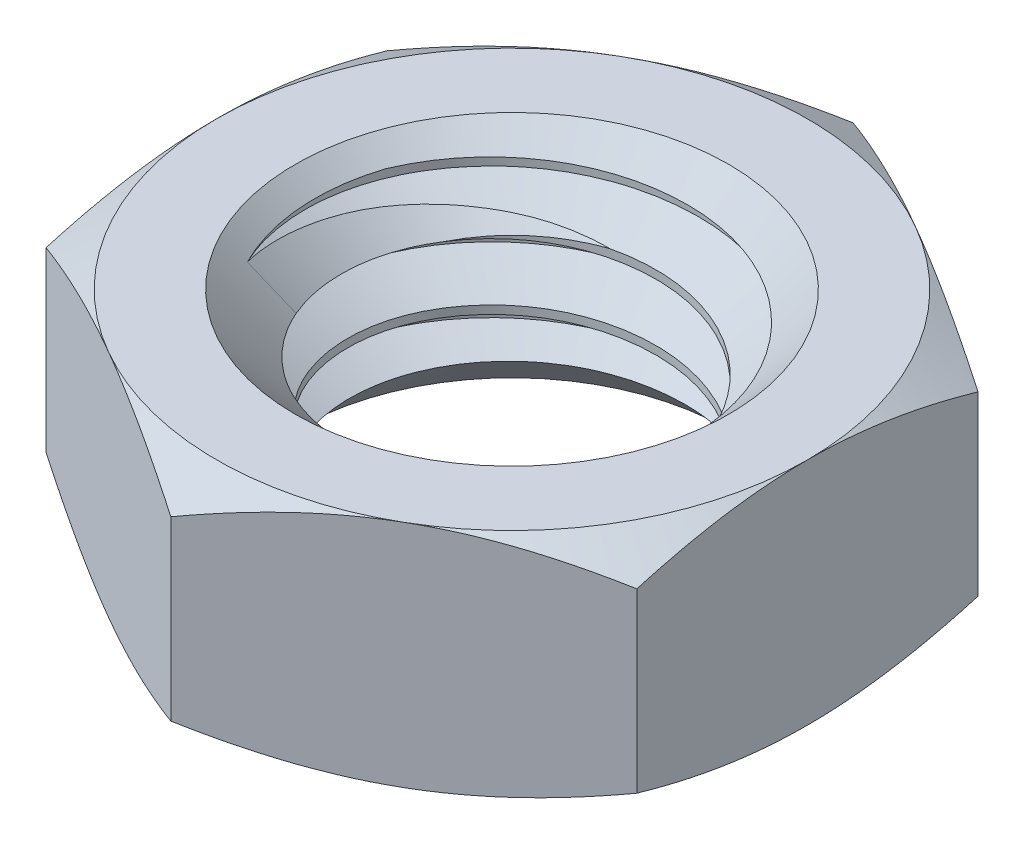
from build123d import *

# Parameters (mm, degrees)
BOSS_EXTRUDE1_DEPTH      = 2.778125
BOSS_EXTRUDE1_DEPTH_BACK = 2.778125
SKETCH2_R                = 4.7625
SKETCH4_R                = 4.7625
BOSS_EXTRUDE2_DEPTH      = 5.55625
CUT_SWEEP1_PITCH         = 1.5875
CUT_SWEEP1_HEIGHT        = 7.14375
CUT_SWEEP1_RADIUS        = 4.7625
CUT_SWEEP1_START_ANGLE   = 180
SKETCH8_R                = 5.23875
BOSS_EXTRUDE3_DEPTH      = 5.55625


with BuildPart() as part:
    # Sketch2 → Boss-Extrude1 (new, two sides: drawn at the far end of the back side and taken through both)
    with BuildSketch(Plane(origin=(0, 0, 0), x_dir=(1, 0, 0), z_dir=(0, 1, 0)).offset(-BOSS_EXTRUDE1_DEPTH_BACK)):
        Polygon((0, 8.248891971), (-7.14375, 4.124445986), (-7.14375, -4.124445986), (0, -8.248891971), (7.14375, -4.124445986), (7.14375, 4.124445986), align=None)
        with Locations(Location((0, 0, 0), (0, 0, 270))):
            Circle(SKETCH2_R, mode=Mode.SUBTRACT)
    extrude(amount=BOSS_EXTRUDE1_DEPTH + BOSS_EXTRUDE1_DEPTH_BACK)

    # Sketch3 → Cut-Revolve1 (revolve, cut)
    with BuildSketch(Plane(origin=(0, 0, 0), x_dir=(0, 0, -1), z_dir=(1, 0, 0))):
        Polygon((-8.248891971, 2.140070986), (-7.14375, 2.778125), (-8.248891971, 2.778125), align=None)
        Polygon((-8.248891971, -2.140070986), (-7.14375, -2.778125), (-8.248891971, -2.778125), align=None)
        Polygon((-5.23875, 2.778125), (-4.7625, 2.778125), (-4.7625, 2.301875), align=None)
        Polygon((-5.23875, -2.778125), (-4.7625, -2.778125), (-4.7625, -2.301875), align=None)
    revolve(axis=Axis((0, 2.778125, 0), (0, -1, 0)), mode=Mode.SUBTRACT)

    # Sketch8 → Boss-Extrude3 (add)
    with BuildSketch(Plane(origin=(0, 2.778125, 0), x_dir=(1, 0, 0), z_dir=(0, 1, 0))):
        Circle(SKETCH8_R)
    extrude(amount=-BOSS_EXTRUDE3_DEPTH)


with BuildPart() as body_2:
    # Sketch4 → Boss-Extrude2 (new body)
    with BuildSketch(Plane(origin=(0, 2.778125, 0), x_dir=(1, 0, 0), z_dir=(0, 1, 0))):
        with Locations(Location((0, 0, 0), (0, 0, 270))):
            Circle(SKETCH4_R)
    extrude(amount=-BOSS_EXTRUDE2_DEPTH)

    # Cut-Sweep1: sweep along a helix
    with BuildLine() as cut_sweep1_path:
        add(Helix(CUT_SWEEP1_PITCH, CUT_SWEEP1_HEIGHT, CUT_SWEEP1_RADIUS, center=(0, 2.778125, 0), direction=(0, -1, 0), mode=Mode.PRIVATE).rotate(Axis((0, 2.778125, 0), (0, -1, 0)), CUT_SWEEP1_START_ANGLE))
    # Sketch6 → Cut-Sweep1 (sweep, cut)
    with BuildSketch(Plane(origin=(0, 0, 0), x_dir=(0, 0, -1), z_dir=(1, 0, 0))):
        Polygon((-4.848425958, 2.728515625), (-4.848425958, 4.216796875), (-3.731388504, 3.571875), (-3.731388504, 3.3734375), align=None)
    sweep(path=cut_sweep1_path.line, is_frenet=True, mode=Mode.SUBTRACT)

    # Sketch7 → Revolve1 (revolve)
    with BuildSketch(Plane(origin=(0, 0, 0), x_dir=(0, 0, -1), z_dir=(1, 0, 0)), mode=Mode.PRIVATE) as revolve1_sk:
        Polygon((-5.23875, 2.778125), (-2.8575, 0.396875), (0, 0.396875), (0, 2.778125), align=None)
        Polygon((-5.23875, -2.778125), (0, -2.778125), (0, -0.396875), (-2.8575, -0.396875), align=None)
    revolve(revolve1_sk.sketch.rotate(Axis((0, -2.778125, 0), (0, 1, 0)), 296.889521784), axis=Axis((0, -2.778125, 0), (0, 1, 0)))


with BuildPart() as part_1:
    add(part.part)

    # Combine1: cut body 2
    add(body_2.part, mode=Mode.SUBTRACT)


solid = part_1.part
